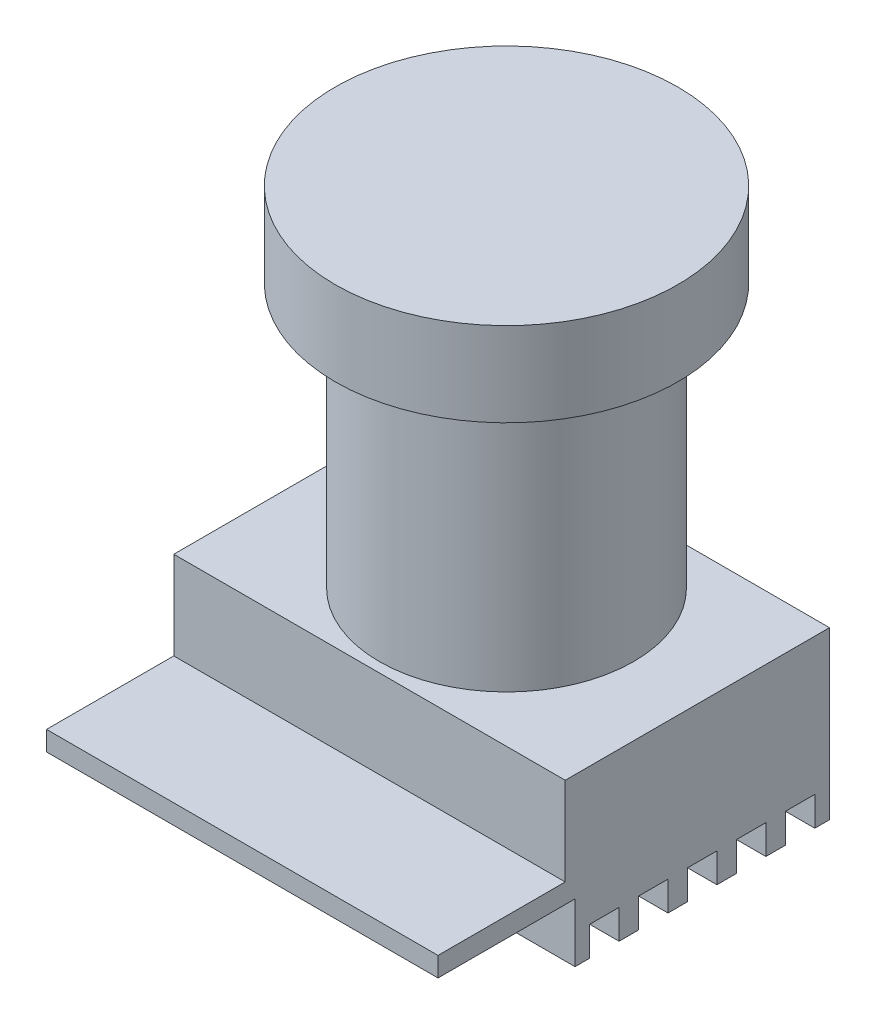
from build123d import *

# Parameters (mm, degrees)
SKETCH1_W             = 20
SKETCH1_H             = 20
PCB_DEPTH             = 1
SKETCH3_W             = 20
SKETCH3_H             = 13
HEATSINK_DEPTH        = 3
SKETCH4_W             = 1.5
SKETCH4_H             = 1.5
HEATSINKPATTERN_DEPTH = 23.561028345
SKETCH5_W             = 20
SKETCH5_H             = 13.5
CAMERABASE_DEPTH      = 4.5
SKETCH6_R             = 6.5
CAMERACYLINDER_DEPTH  = 13.5
SKETCH7_R             = 8.75
LENS_DEPTH            = 4.3


with BuildPart() as part:
    # Sketch1 → PCB (new body)
    with BuildSketch(Plane(origin=(0, 0, 0), x_dir=(1, 0, 0), z_dir=(0, 1, 0))):
        Rectangle(SKETCH1_W, SKETCH1_H)
    extrude(amount=PCB_DEPTH)

    # Sketch3 → HeatSink (add)
    with BuildSketch(Plane.XZ):
        with Locations((0, -3.5)):
            Rectangle(SKETCH3_W, SKETCH3_H)
    extrude(amount=HEATSINK_DEPTH)

    # Sketch4 → HeatSinkPattern (cut, through all)
    with BuildSketch(Plane.ZY.offset(10)):
        with Locations((-1, -2.25)):
            Rectangle(SKETCH4_W, SKETCH4_H)
        with Locations((-3.5, -2.25)):
            Rectangle(SKETCH4_W, SKETCH4_H)
        with Locations((1.5, -2.25)):
            Rectangle(SKETCH4_W, SKETCH4_H)
        with Locations((-6, -2.25)):
            Rectangle(SKETCH4_W, SKETCH4_H)
        with Locations((-8.5, -2.25)):
            Rectangle(SKETCH4_W, SKETCH4_H)
    extrude(amount=-HEATSINKPATTERN_DEPTH, mode=Mode.SUBTRACT)

    # Sketch5 → CameraBase (add)
    with BuildSketch(Plane(origin=(0, 1, 0), x_dir=(1, 0, 0), z_dir=(0, 1, 0))):
        with Locations((0, 3.25)):
            Rectangle(SKETCH5_W, SKETCH5_H)
    extrude(amount=CAMERABASE_DEPTH)

    # Sketch6 → CameraCylinder (add)
    with BuildSketch(Plane(origin=(0, 5.5, 0), x_dir=(1, 0, 0), z_dir=(0, 1, 0))):
        with Locations(Location((0, 3.5, 0), (0, 0, 90))):
            Circle(SKETCH6_R)
    extrude(amount=CAMERACYLINDER_DEPTH)

    # Sketch7 → Lens (add)
    with BuildSketch(Plane(origin=(0, 19, 0), x_dir=(1, 0, 0), z_dir=(0, 1, 0))):
        with Locations(Location((0, 3.5, 0), (0, 0, 90))):
            Circle(SKETCH7_R)
    extrude(amount=LENS_DEPTH)


solid = part.part
